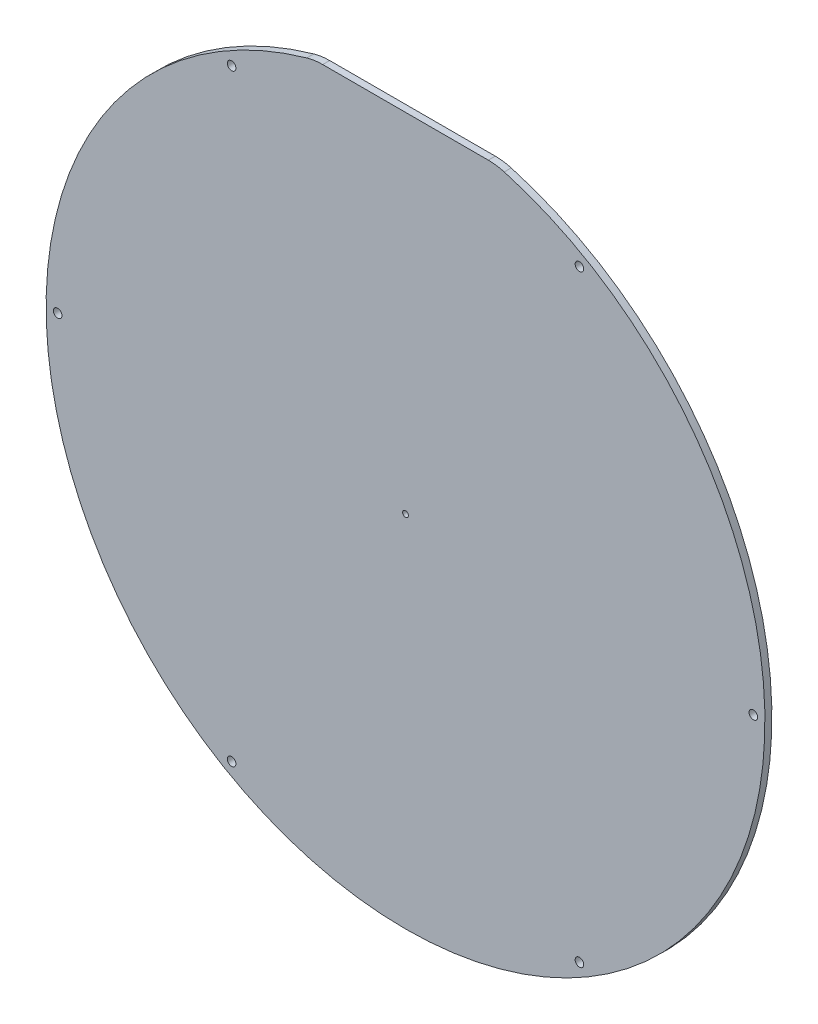
from build123d import *

# Parameters (mm, degrees)
SKETCH1_R               = 155
SKETCH1_R_2             = 1.25
BOSS_EXTRUDE1_DEPTH     = 3
SKETCH2_R               = 1.85
CUT_EXTRUDE1_DEPTH      = 220.223630113
CIRPATTERN1_COUNT       = 6
CUT_EXTRUDE2_DEPTH      = 220.223630113
CUT_EXTRUDE2_DEPTH_BACK = 220.223630113
FILLET1_R               = 25


with BuildPart() as part:
    # Sketch1 → Boss-Extrude1 (new body)
    with BuildSketch(Plane.XY):
        Circle(SKETCH1_R)
        Circle(SKETCH1_R_2, mode=Mode.SUBTRACT)
    extrude(amount=BOSS_EXTRUDE1_DEPTH)

    # Sketch2 → Cut-Extrude1 (cut, through all)
    with BuildSketch(Plane.XY.offset(3)):
        with Locations((-150, 0)):
            Circle(SKETCH2_R)
    cut_extrude1 = extrude(amount=-CUT_EXTRUDE1_DEPTH, mode=Mode.SUBTRACT)

    # CirPattern1: Cut-Extrude1 ×6 about axis
    cirpattern1_axis = Axis((0, 0, 3), (0, 0, 1))
    for i in range(1, CIRPATTERN1_COUNT):
        add(cut_extrude1.rotate(cirpattern1_axis, i * 360 / CIRPATTERN1_COUNT), mode=Mode.SUBTRACT)

    # Sketch18 → Cut-Extrude2 (cut, two sides: drawn at the far end of the back side and taken through both)
    with BuildSketch(Plane.XY.offset(3).offset(-CUT_EXTRUDE2_DEPTH_BACK)):
        Polygon((-816.796213875, 150), (-60.219206673, 150), (46.353365048, 150), (802.93037225, 150), (802.93037225, 1663.154014405), (-816.796213875, 1663.154014405), align=None)
    extrude(amount=CUT_EXTRUDE2_DEPTH + CUT_EXTRUDE2_DEPTH_BACK, mode=Mode.SUBTRACT)

    # Fillet1
    fillet1_edges = [part.edges().sort_by_distance(p)[0] for p in [
        (39.05124838, 150, 1.5),
        (-39.05124838, 150, 1.5),
    ]]
    fillet(fillet1_edges, radius=FILLET1_R)


solid = part.part
